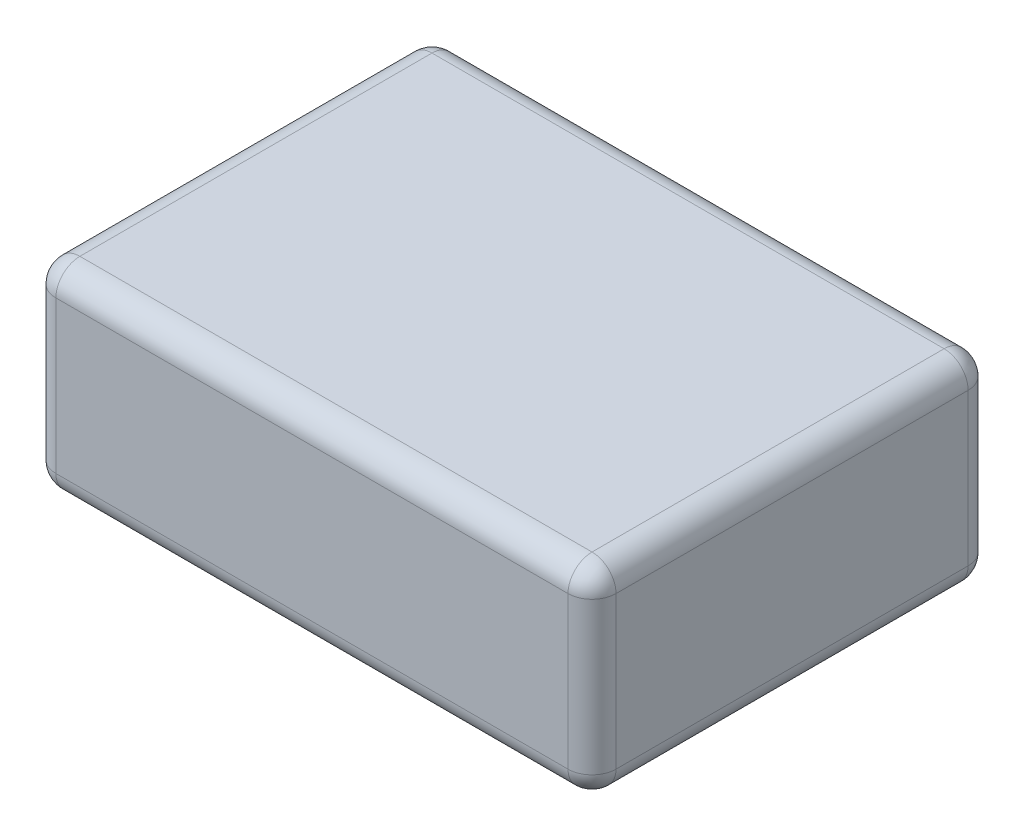
from build123d import *

# Parameters (mm, degrees)
SKETCH2_W           = 177.8
SKETCH2_H           = 127
BOSS_EXTRUDE1_DEPTH = 63.5
FILLET1_R           = 7.62
FILLET2_R           = 7.62
FILLET3_R           = 7.62


with BuildPart() as part:
    # Sketch2 → Boss-Extrude1 (new body)
    with BuildSketch(Plane(origin=(0, 0, 0), x_dir=(1, 0, 0), z_dir=(0, 1, 0))):
        Rectangle(SKETCH2_W, SKETCH2_H)
    extrude(amount=BOSS_EXTRUDE1_DEPTH)

    # Fillet1
    fillet1_edges = [part.edges().sort_by_distance(p)[0] for p in [
        (-88.9, 63.5, 0),
        (0, 63.5, 63.5),
        (-88.9, 31.75, 63.5),
    ]]
    fillet(fillet1_edges, radius=FILLET1_R)

    # Fillet2
    fillet2_edges = [part.edges().sort_by_distance(p)[0] for p in [
        (88.9, 27.94, 63.5),
        (88.9, 63.5, -3.81),
        (88.9, 61.268153673, 61.268153673),
    ]]
    fillet(fillet2_edges, radius=FILLET2_R)

    # Fillet3
    fillet3_edges = [part.edges().sort_by_distance(p)[0] for p in [
        (0, 0, 63.5),
        (-86.668153673, 0, 61.268153673),
        (-88.9, 27.94, -63.5),
        (-86.668153673, 61.268153673, -63.5),
        (0, 63.5, -63.5),
        (88.9, 27.94, -63.5),
        (86.668153673, 61.268153673, -63.5),
        (88.9, 0, -3.81),
        (86.668153673, 0, 61.268153673),
        (-88.9, 0, -3.81),
        (0, 0, -63.5),
    ]]
    fillet(fillet3_edges, radius=FILLET3_R)


solid = part.part
